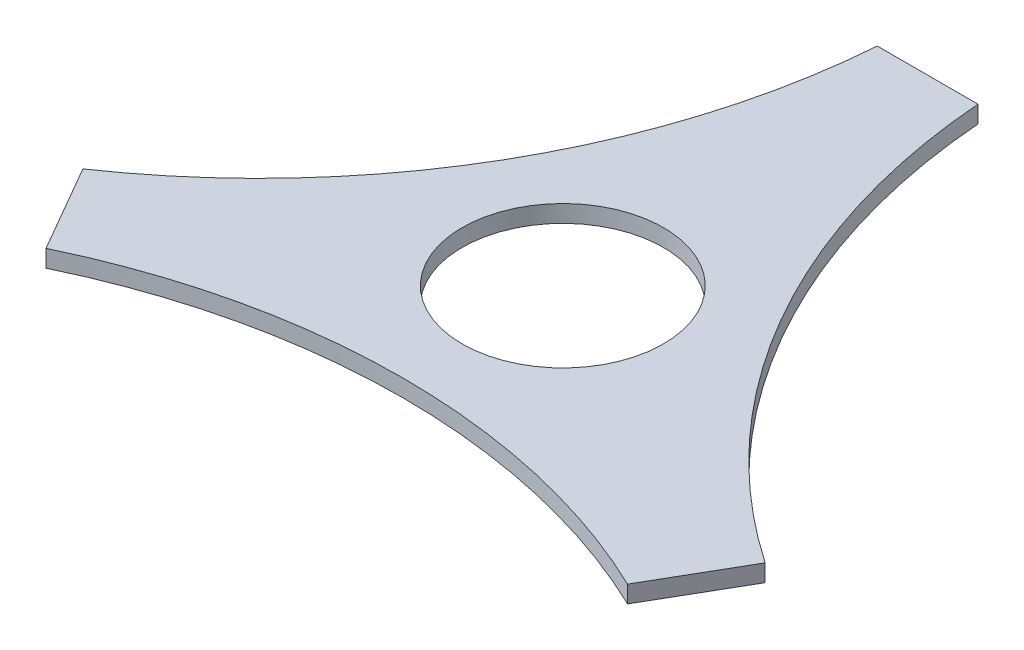
from build123d import *

# Parameters (mm, degrees)
BOSS_EXTRUDE1_DEPTH = 1.6256
SKETCH3_R           = 19.05
CUT_EXTRUDE2_DEPTH  = 95.519790354


with BuildPart() as part:
    # Sketch1 → Boss-Extrude1 (new, symmetric)
    with BuildSketch(Plane(origin=(0, 0, 0), x_dir=(1, 0, 0), z_dir=(0, 1, 0))):
        with BuildLine():
            ThreePointArc((-64.51761314, -26.250738686), (-26.175423514, 15.112387812), (-9.525, 68.999261314))
            Line((-9.525, 68.999261314), (-9.525, 5.499261314))
            Line((-9.525, 5.499261314), (-64.51761314, -26.250738686))
        make_face()
        Polygon((-9.525, 5.499261314), (-9.525, 68.999261314), (9.525, 68.999261314), (9.525, 5.499261314), (64.51761314, -26.250738686), (54.99261314, -42.748522628), (0, -10.998522628), (-54.99261314, -42.748522628), (-64.51761314, -26.250738686), align=None)
        with BuildLine():
            ThreePointArc((54.99261314, -42.748522628), (0, -30.224775624), (-54.99261314, -42.748522628))
            Line((-54.99261314, -42.748522628), (0, -10.998522628))
            Line((0, -10.998522628), (54.99261314, -42.748522628))
        make_face()
        with BuildLine():
            ThreePointArc((9.525, 68.999261314), (26.175423514, 15.112387812), (64.51761314, -26.250738686))
            Line((64.51761314, -26.250738686), (9.525, 5.499261314))
            Line((9.525, 5.499261314), (9.525, 68.999261314))
        make_face()
    extrude(amount=BOSS_EXTRUDE1_DEPTH, both=True)

    # Sketch3 → Cut-Extrude2 (cut, through all)
    with BuildSketch(Plane(origin=(0, 1.6256, 0), x_dir=(1, 0, 0), z_dir=(0, 1, 0))):
        with Locations(Location((0, 0, 0), (0, 0, 270))):
            Circle(SKETCH3_R)
    extrude(amount=-CUT_EXTRUDE2_DEPTH, mode=Mode.SUBTRACT)


solid = part.part
